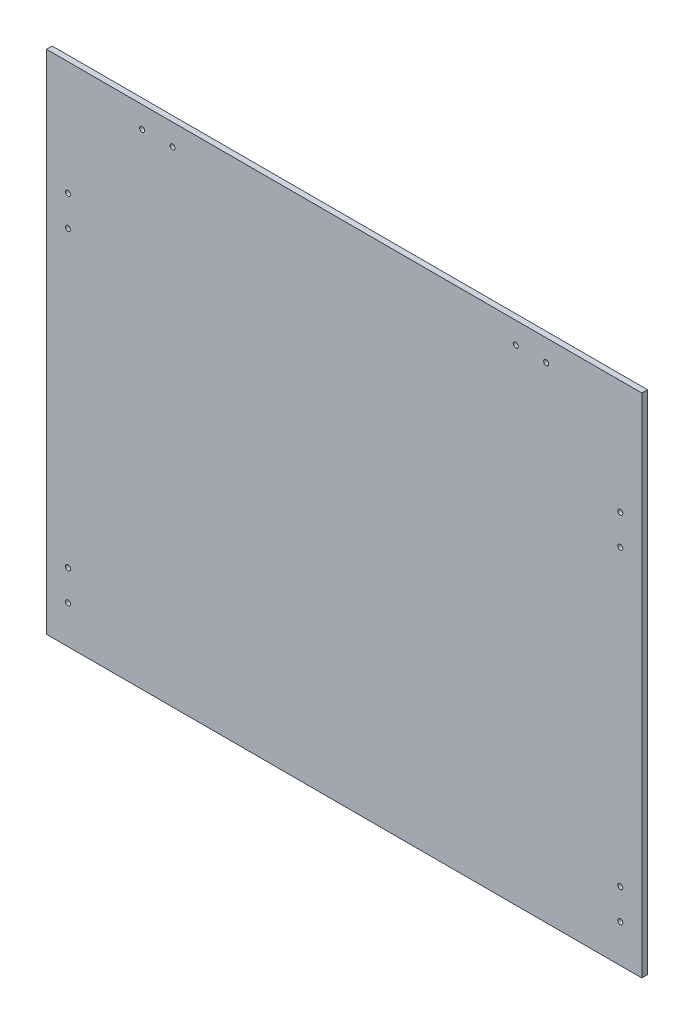
from build123d import *

# Parameters (mm, degrees)
SKETCH_1_W          = 470
SKETCH_1_H          = 400
EXTRUDE_1_DEPTH     = 4.5
SKETCH_2_R          = 2
CUT_EXTRUDE_1_DEPTH = 10


with BuildPart() as part:
    # 草图1 → 凸台-拉伸1 (new body)
    with BuildSketch(Plane.XY):
        with Locations((235, 200)):
            Rectangle(SKETCH_1_W, SKETCH_1_H)
    extrude(amount=EXTRUDE_1_DEPTH)

    # 草图2 → 切除-拉伸1 (cut)
    with BuildSketch(Plane.XY.offset(4.5)):
        with Locations((99.5, 383)):
            Circle(SKETCH_2_R)
        with Locations((75.5, 383)):
            Circle(SKETCH_2_R)
        with Locations((17, 310)):
            Circle(SKETCH_2_R)
        with Locations((17, 286)):
            Circle(SKETCH_2_R)
        with Locations((17, 54)):
            Circle(SKETCH_2_R)
        with Locations((17, 30)):
            Circle(SKETCH_2_R)
        with Locations(Location((453, 30, 0), (0, 0, 180))):
            Circle(SKETCH_2_R)
        with Locations(Location((453, 54, 0), (0, 0, 180))):
            Circle(SKETCH_2_R)
        with Locations(Location((453, 286, 0), (0, 0, 180))):
            Circle(SKETCH_2_R)
        with Locations(Location((453, 310, 0), (0, 0, 180))):
            Circle(SKETCH_2_R)
        with Locations(Location((394.5, 383, 0), (0, 0, 180))):
            Circle(SKETCH_2_R)
        with Locations(Location((370.5, 383, 0), (0, 0, 180))):
            Circle(SKETCH_2_R)
    extrude(amount=-CUT_EXTRUDE_1_DEPTH, mode=Mode.SUBTRACT)


solid = part.part
